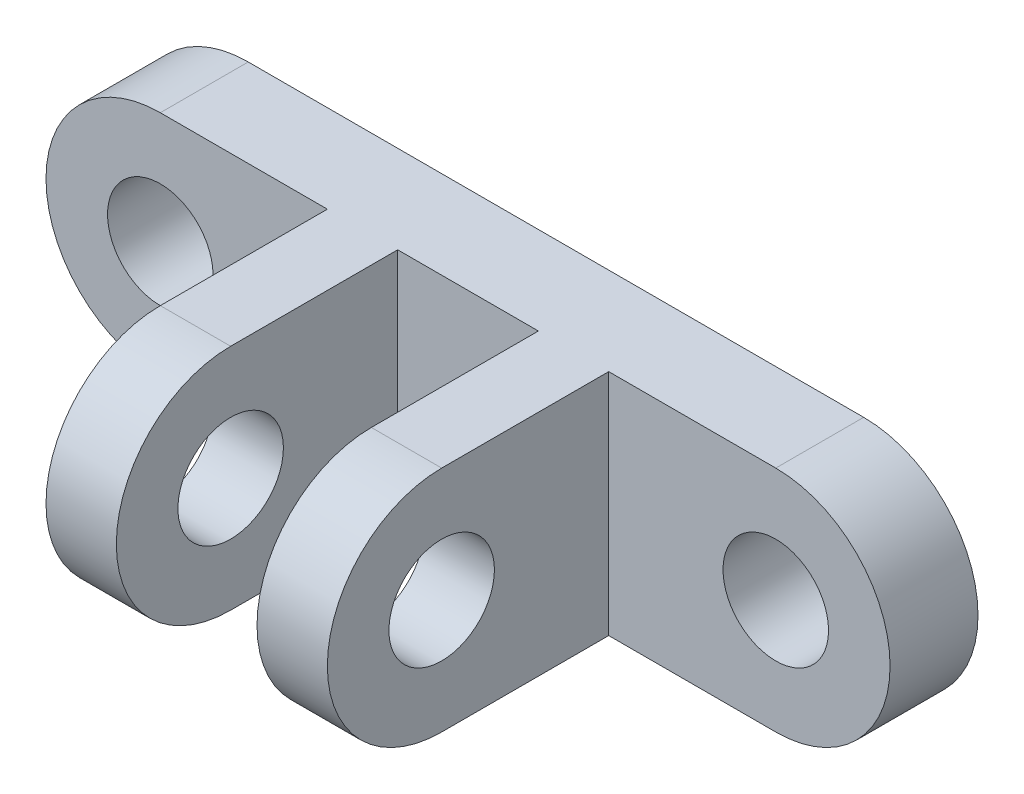
from build123d import *

# Parameters (mm, degrees)
SKETCH1_R           = 6
BOSS_EXTRUDE1_DEPTH = 10
BOSS_EXTRUDE2_START = 8
SKETCH3_R           = 6
BOSS_EXTRUDE2_DEPTH = 8


with BuildPart() as part:
    # Sketch1 → Boss-Extrude1 (new body)
    with BuildSketch(Plane.XY):
        with BuildLine():
            Line((-35, 13), (35, 13))
            ThreePointArc((35, 13), (48, 0), (35, -13))
            Line((35, -13), (-35, -13))
            ThreePointArc((-35, -13), (-48, 0), (-35, 13))
        make_face()
        with Locations((-35, 0)):
            Circle(SKETCH1_R, mode=Mode.SUBTRACT)
        with Locations((35, 0)):
            Circle(SKETCH1_R, mode=Mode.SUBTRACT)
    extrude(amount=BOSS_EXTRUDE1_DEPTH)

    # Sketch3 → Boss-Extrude2 (add)
    with BuildSketch(Plane(origin=(0, 0, 0), x_dir=(0, 0, -1), z_dir=(1, 0, 0)).offset(BOSS_EXTRUDE2_START)):
        with BuildLine():
            Line((-10, -13), (-29, -13))
            ThreePointArc((-29, -13), (-42, 0), (-29, 13))
            Line((-29, 13), (-10, 13))
            Line((-10, 13), (-10, -13))
        make_face()
        with Locations((-29, 0)):
            Circle(SKETCH3_R, mode=Mode.SUBTRACT)
    boss_extrude2 = extrude(amount=BOSS_EXTRUDE2_DEPTH)

    # Mirror1: Boss-Extrude2 across plane
    add(boss_extrude2.mirror(Plane(origin=(0, 0, 0), x_dir=(0, 0, 1), z_dir=(1, 0, 0))))


solid = part.part
